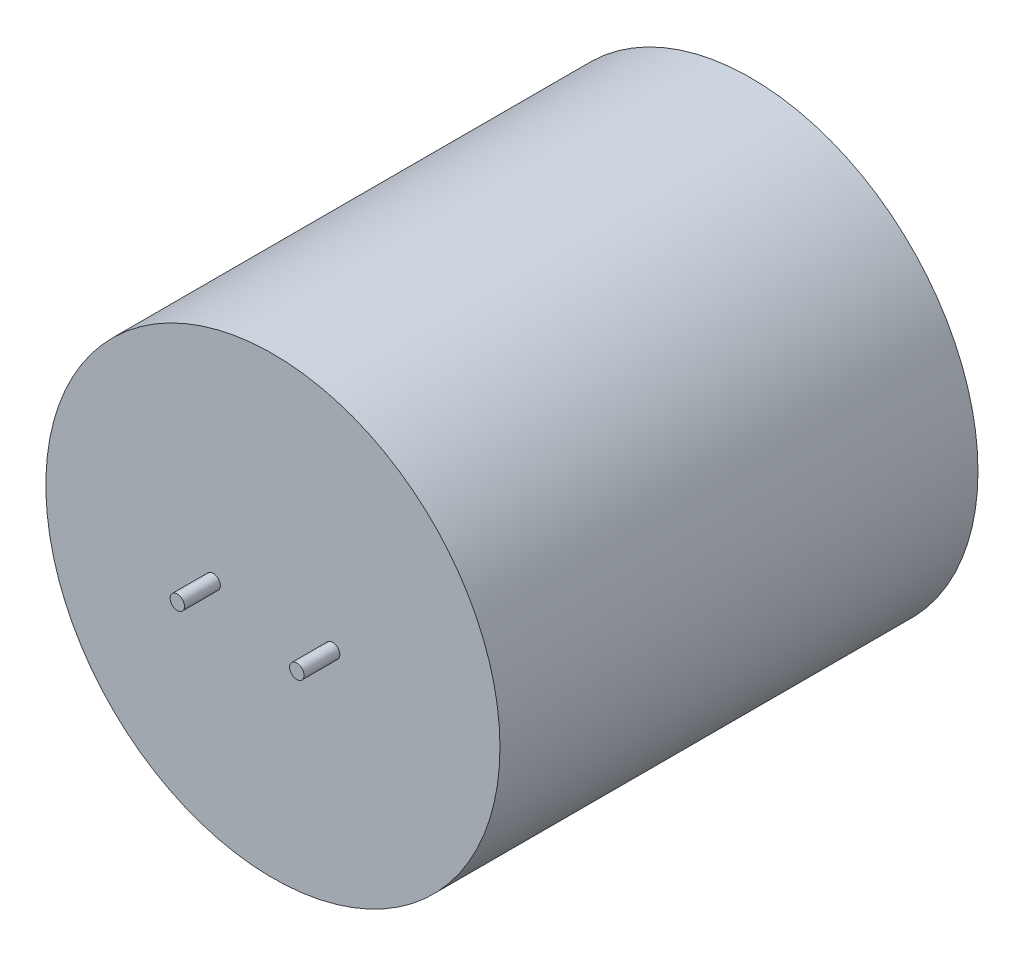
from build123d import *

# Parameters (mm, degrees)
SKETCH_1_R      = 19
EXTRUDE_1_DEPTH = 40
SKETCH_2_R      = 0.6
EXTRUDE_2_DEPTH = 3


with BuildPart() as part:
    # Эскиз1 → Вытянуть1 (new body)
    with BuildSketch(Plane.XY):
        Circle(SKETCH_1_R)
    extrude(amount=EXTRUDE_1_DEPTH)

    # Эскиз2 → Вытянуть2 (add)
    with BuildSketch(Plane.XY.offset(40)):
        with Locations((-5, 0)):
            Circle(SKETCH_2_R)
        with Locations((5, 0)):
            Circle(SKETCH_2_R)
    extrude(amount=EXTRUDE_2_DEPTH)


solid = part.part
